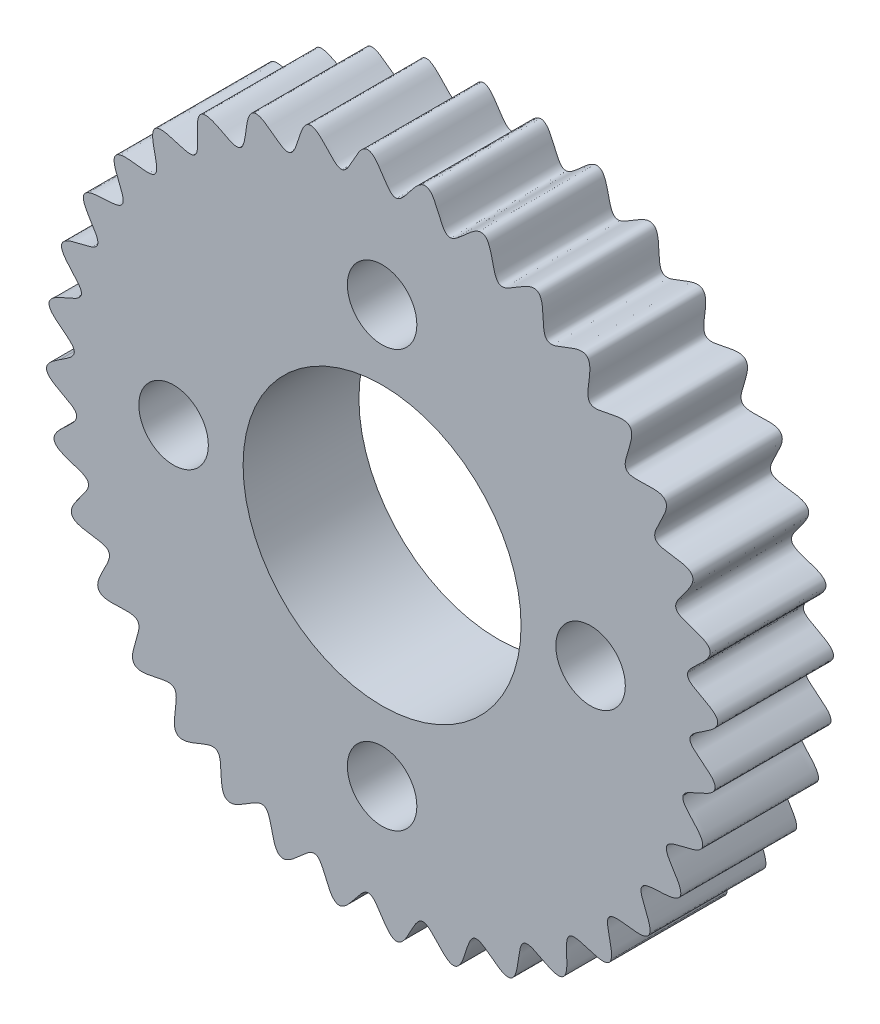
from build123d import *

# Parameters (mm, degrees)
SKETCH_1_R          = 12
EXTRUDE_1_DEPTH     = 10
SKETCH_2_R          = 3
CUT_EXTRUDE_1_DEPTH = 10


with BuildPart() as part:
    # 草图1 → 凸台-拉伸1 (new body)
    with BuildSketch(Plane.XY):
        with BuildLine():
            add(Edge.make_bspline(
                [(27.8, 0), (27.879086903, 0.050893887), (27.971336732, 0.111103249), (28.194533481, 0.258808628), (28.294049855, 0.336092728), (28.417370088, 0.426086376), (28.501278415, 0.498040732), (28.622785002, 0.60193849), (28.715550657, 0.697734174), (28.807132403, 0.807680639), (28.870681996, 0.900507067), (28.936409474, 1.025538972), (28.984042853, 1.184831126), (28.973296669, 1.377900934), (28.880794908, 1.571235405), (28.750315987, 1.731505647), (28.547325084, 1.91602641), (28.265698227, 2.109835643), (27.910306403, 2.312106458), (27.539864559, 2.503239109), (27.223608825, 2.669344446), (26.927397078, 2.838734122), (26.700188585, 2.990953033), (26.498086038, 3.166743573), (26.370908864, 3.391004275), (26.356430991, 3.592019791), (26.430018399, 3.818671801), (26.56512916, 4.020814312), (26.730827575, 4.211649336), (26.917184592, 4.399244762), (27.084143049, 4.557202823), (27.253332176, 4.712918318), (27.422614194, 4.868396469), (27.590305373, 5.025738359), (27.754250066, 5.186850897), (27.911041976, 5.352895005), (28.056676237, 5.526394246), (28.186171878, 5.710966213), (28.287869973, 5.910349115), (28.34201641, 6.126003938), (28.312098938, 6.345259812), (28.172373356, 6.573230019), (27.960820756, 6.740200125), (27.721028536, 6.872546037), (27.461750224, 6.984182042), (27.238477196, 7.067688137), (27.012456826, 7.144181074), (26.785443426, 7.216899189), (26.557892275, 7.288618547), (26.331273922, 7.362408013), (26.113781842, 7.43906723), (25.908178465, 7.52274658), (25.715756985, 7.61834712), (25.544697275, 7.733280458), (25.400011883, 7.885351659), (25.330486689, 8.087592553), (25.354871409, 8.296728464), (25.425840851, 8.490064125), (25.526610466, 8.679819619), (25.645961339, 8.866813634), (25.779416237, 9.05472223), (25.92239085, 9.24525649), (26.103745171, 9.481697328), (26.283943101, 9.718875409), (26.457504471, 9.961190202), (26.611206515, 10.207142911), (26.715361124, 10.403517182), (26.79562524, 10.602702602), (26.842072945, 10.804243307), (26.836798525, 11.013987828), (26.75119136, 11.207759856), (26.564257659, 11.390904846), (26.323655987, 11.510151758), (26.063101473, 11.593758588), (25.788074573, 11.65561909), (25.553656692, 11.697354098), (25.317978038, 11.732462675), (25.082005189, 11.764169314), (24.845804513, 11.795450723), (24.610177946, 11.829379504), (24.383256136, 11.86874231), (24.166933345, 11.917715336), (23.962395363, 11.982992828), (23.776853656, 12.07267222), (23.620775011, 12.205970898), (23.538369624, 12.389782291), (23.531717159, 12.58147316), (23.562982453, 12.762897328), (23.620808426, 12.949847233), (23.697496498, 13.14188267), (23.813453435, 13.392298028), (23.944533062, 13.648015836), (24.077803909, 13.90261077), (24.207499367, 14.159076038), (24.306457278, 14.366565583), (24.397004178, 14.576211413), (24.474508501, 14.789059923), (24.53308054, 15.006794776), (24.560430992, 15.228926187), (24.537586129, 15.450111193), (24.434435544, 15.6458875), (24.26640897, 15.779613952), (24.076288525, 15.861486218), (23.809455077, 15.927118569), (23.468554136, 15.958819166), (23.118724552, 15.958945935), (22.761289762, 15.945389342), (22.46342862, 15.932420039), (22.225194411, 15.924210208), (21.994627654, 15.921885696), (21.772787608, 15.930183232), (21.559281487, 15.954213572), (21.359224813, 16.003707181), (21.171254791, 16.097121806), (21.036752381, 16.263389544), (20.988135782, 16.468247409), (20.988705496, 16.674208308), (21.018487147, 16.886961041), (21.066704156, 17.103542736), (21.14362914, 17.383196742), (21.250439114, 17.724245634), (21.358755746, 18.06503286), (21.454982526, 18.409430546), (21.515312013, 18.693159268), (21.5460116, 18.913291704), (21.553315265, 19.127929077), (21.528028111, 19.333195278), (21.451336325, 19.528489846), (21.304617219, 19.681294935), (21.066318218, 19.789460951), (20.79944135, 19.819224862), (20.526005267, 19.808675346), (20.24640681, 19.772740077), (20.011851936, 19.731782731), (19.778378556, 19.684167041), (19.545792313, 19.633254106), (19.313137432, 19.581863655), (19.080116496, 19.533157143), (18.853416991, 19.492534458), (18.633390103, 19.464566953), (18.418861342, 19.455952127), (18.213836575, 19.476763423), (18.021580452, 19.548642329), (17.881276504, 19.693182449), (17.809464837, 19.871040739), (17.776790566, 20.052211205), (17.767194822, 20.247675312), (17.773566186, 20.454337552), (17.792043882, 20.672043753), (17.818304504, 20.900375354), (17.847881812, 21.128406721), (17.8775822, 21.356326194), (17.904926068, 21.5846444), (17.926940799, 21.813447093), (17.940326438, 22.041426775), (17.940362404, 22.267948189), (17.920921514, 22.492575075), (17.870667982, 22.710683722), (17.77352218, 22.910686442), (17.609675518, 23.059419976), (17.356091166, 23.14423359), (17.086730496, 23.136172503), (16.817922967, 23.083390388), (16.490432854, 22.985136235), (16.211054636, 22.881047447), (15.934942337, 22.768604598), (15.659525205, 22.654511151), (15.438440123, 22.565334618), (15.222589959, 22.484279802), (15.011280808, 22.416209654), (14.802436989, 22.365764804), (14.597514908, 22.343850084), (14.388932374, 22.367343664), (14.205674013, 22.477577459), (14.089923895, 22.653461062), (14.020016996, 22.847180019), (13.975235357, 23.057320162), (13.946472471, 23.277273078), (13.927908085, 23.507019631), (13.914978441, 23.744852499), (13.904506054, 23.983050193), (13.893282615, 24.221046437), (13.878354587, 24.458988334), (13.856415244, 24.696296421), (13.824330138, 24.924495378), (13.777909065, 25.141850386), (13.711350077, 25.346041523), (13.617389698, 25.530280879), (13.478523219, 25.687565835), (13.288394893, 25.78097755), (13.027464627, 25.801111984), (12.766516586, 25.737814401), (12.513153333, 25.634360605), (12.209785855, 25.477632394), (11.902783133, 25.294859669), (11.60197022, 25.101924315), (11.300186174, 24.910902555), (11.049608034, 24.765235253), (10.852367464, 24.663707124), (10.653749362, 24.582235009), (10.453957778, 24.531670512), (10.248719233, 24.533458118), (10.067436975, 24.621295193), (9.939127491, 24.763865927), (9.846458097, 24.922935447), (9.770589556, 25.103329535), (9.705893204, 25.299707745), (9.648797188, 25.510604368), (9.59537974, 25.734147527), (9.545182259, 25.958543039), (9.495138198, 26.18287525), (9.442743899, 26.406776632), (9.385175425, 26.629309812), (9.319780829, 26.848119633), (9.242338695, 27.060991081), (9.147244881, 27.265424181), (9.025422115, 27.453188474), (8.865733384, 27.607908228), (8.660893166, 27.691626792), (8.39360259, 27.684606044), (8.143225768, 27.58488113), (7.90871486, 27.443387961), (7.682396011, 27.274664342), (7.498441146, 27.123057281), (7.319186096, 26.965564369), (7.142703698, 26.805324045), (6.966817291, 26.644118669), (6.789604628, 26.484756111), (6.614469657, 26.334732122), (6.439199682, 26.19851394), (6.260196224, 26.079672478), (6.075131506, 25.988996859), (5.871090792, 25.939731587), (5.661183212, 25.980640903), (5.492257219, 26.106327599), (5.360310917, 26.264454938), (5.246357455, 26.44660543), (5.144101081, 26.643456374), (5.048078172, 26.852997932), (4.954584737, 27.072065638), (4.863275451, 27.292316419), (4.771329389, 27.512121131), (4.675920691, 27.730607665), (4.574140318, 27.946100641), (4.465941534, 28.149563755), (4.347980207, 28.337933716), (4.215597733, 28.507046103), (4.064290289, 28.648038125), (3.880003859, 28.748342504), (3.669392986, 28.771093086), (3.417312359, 28.700769858), (3.193750459, 28.5520401), (2.991050161, 28.368169996), (2.759582186, 28.117135864), (2.533605948, 27.840384568), (2.31692205, 27.556200564), (2.098671099, 27.273482603), (1.913025822, 27.050897343), (1.762404978, 26.888031862), (1.603630118, 26.743541724), (1.433181517, 26.627693893), (1.239708974, 26.559177977), (1.039317325, 26.579715644), (0.869983787, 26.669803882), (0.728498061, 26.787585538), (0.595506541, 26.931151962), (0.467546553, 27.093559661), (0.341762955, 27.272209674), (0.21511071, 27.464001687), (0.091192722, 27.657695945), (-0.032559447, 27.85138319), (-0.158372766, 28.043861761), (-0.288580267, 28.233284971), (-0.424868452, 28.416532676), (-0.570446577, 28.590079635), (-0.729725771, 28.749659911), (-0.908420895, 28.884434791), (-1.11139649, 28.975207041), (-1.332516766, 28.983817275), (-1.581286513, 28.885801171), (-1.782455831, 28.706456485), (-1.954430496, 28.493288951), (-2.109393756, 28.257334995), (-2.230402144, 28.05195471), (-2.344980994, 27.842650907), (-2.456014868, 27.631713786), (-2.566158397, 27.420073482), (-2.678178866, 27.209711543), (-2.79144028, 27.008835121), (-2.909551449, 26.820886509), (-3.0371126, 26.647988599), (-3.180005, 26.49948653), (-3.354888818, 26.383404771), (-3.566132369, 26.35005668), (-3.767852793, 26.410383356), (-3.945934951, 26.513853988), (-4.115294339, 26.646029356), (-4.278749293, 26.796063883), (-4.482477508, 27.002533923), (-4.724423488, 27.265513776), (-4.965405567, 27.529786358), (-5.215535578, 27.785218378), (-5.469388732, 28.013960538), (-5.689003034, 28.1774426), (-5.927139279, 28.302524486), (-6.186505546, 28.341682864), (-6.392189073, 28.290966382), (-6.605021186, 28.138715389), (-6.764225659, 27.922442246), (-6.891822069, 27.680389774), (-7.00048006, 27.42026614), (-7.082320502, 27.196669711), (-7.1577628, 26.970654543), (-7.230062219, 26.743789915), (-7.301720669, 26.516583786), (-7.376317268, 26.29046888), (-7.47146589, 26.025331105), (-7.581966336, 25.775207319), (-7.719978263, 25.545598316), (-7.91873902, 25.381454162), (-8.114215905, 25.33223945), (-8.304054838, 25.358963631), (-8.477354917, 25.421261642), (-8.651384434, 25.51067688), (-8.827205101, 25.61953041), (-9.00648562, 25.744382769), (-9.191108118, 25.881292661), (-9.373793464, 26.02092205), (-9.556331461, 26.160603638), (-9.740386424, 26.298442941), (-9.92752948, 26.43190969), (-10.118271979, 26.557491923), (-10.314427805, 26.6707835), (-10.518680562, 26.76626113), (-10.732695105, 26.831793843), (-10.954475347, 26.847665621), (-11.165205772, 26.780135375), (-11.365448599, 26.602934644), (-11.493147988, 26.36562499), (-11.581840827, 26.106450664), (-11.660495752, 25.773689917), (-11.710040486, 25.479731727), (-11.750719678, 25.184331504), (-11.78961839, 24.888851215), (-11.822935166, 24.652656734), (-11.869089644, 24.374648785), (-11.930455835, 24.107647888), (-12.020423793, 23.85585111), (-12.176220373, 23.644905792), (-12.363316911, 23.541228897), (-12.573510252, 23.528986279), (-12.776230159, 23.56526564), (-12.980607076, 23.631580147), (-13.185473721, 23.716628664), (-13.393722076, 23.815436641), (-13.606156223, 23.923148187), (-13.817677815, 24.033182545), (-14.029399983, 24.142457297), (-14.242928364, 24.248503474), (-14.459411755, 24.34815362), (-14.673082255, 24.434471979), (-14.884524819, 24.502939723), (-15.094643237, 24.547404599), (-15.301173185, 24.558136063), (-15.506828442, 24.516540603), (-15.682775618, 24.398554571), (-15.801121159, 24.225884742), (-15.874675821, 24.032755026), (-15.920324819, 23.823057751), (-15.94581756, 23.6023968), (-15.956611013, 23.372354624), (-15.956981754, 23.134192807), (-15.950646527, 22.896033778), (-15.940886259, 22.658118456), (-15.930682082, 22.420087368), (-15.923175868, 22.182140743), (-15.922538306, 21.951836115), (-15.933201792, 21.730292616), (-15.961970995, 21.517528576), (-16.018067986, 21.319231688), (-16.122239981, 21.142378408), (-16.288947642, 21.029304894), (-16.47657389, 20.989469119), (-16.660665756, 20.988751066), (-16.85482664, 21.013243166), (-17.057242811, 21.055404186), (-17.268432978, 21.111405523), (-17.488735561, 21.176916459), (-17.70816663, 21.245641791), (-17.927465986, 21.314468546), (-18.147567461, 21.381044397), (-18.369071061, 21.442455254), (-18.591263237, 21.495226766), (-18.814336378, 21.534595645), (-19.038927547, 21.554458531), (-19.262447575, 21.542839069), (-19.476283179, 21.481904448), (-19.651205691, 21.346366898), (-19.778770833, 21.111376094), (-19.817594935, 20.844680949), (-19.81231371, 20.57084196), (-19.779354195, 20.290482279), (-19.740036061, 20.055369162), (-19.693270723, 19.821383279), (-19.642739731, 19.588424877), (-19.591074983, 19.355500092), (-19.541669291, 19.122348145), (-19.499312191, 18.895664817), (-19.468978772, 18.675767475), (-19.455560776, 18.461325202), (-19.469565746, 18.255716645), (-19.528921126, 18.054379567), (-19.669303422, 17.893048929), (-19.862614291, 17.809598075), (-20.065529734, 17.774392897), (-20.280253421, 17.766781546), (-20.501859521, 17.776650408), (-20.731339296, 17.798262895), (-20.967804199, 17.82682908), (-21.204201635, 17.857878274), (-21.440531095, 17.888153062), (-21.677450392, 17.914769878), (-21.91496287, 17.934372137), (-22.145266651, 17.942400534), (-22.367380229, 17.934428426), (-22.580027459, 17.904337436), (-22.777783311, 17.843798234), (-22.956793469, 17.734352395), (-23.081800307, 17.563335231), (-23.14694111, 17.309861839), (-23.12991394, 17.041893758), (-23.072035792, 16.774402326), (-22.970354515, 16.448449706), (-22.864805878, 16.170015681), (-22.75181371, 15.894557836), (-22.638067504, 15.619401873), (-22.549628737, 15.398330635), (-22.470262459, 15.182159429), (-22.404509768, 14.970314206), (-22.358774448, 14.760549826), (-22.343667363, 14.555021541), (-22.381068548, 14.353206659), (-22.499050915, 14.18993437), (-22.66173404, 14.088328639), (-22.834484452, 14.024692473), (-23.025301005, 13.981296753), (-23.229952322, 13.951692454), (-23.504797355, 13.926906874), (-23.791794416, 13.912565626), (-24.078916858, 13.900684977), (-24.365868147, 13.884770724), (-24.595041472, 13.86672796), (-24.821867892, 13.840317501), (-25.044961638, 13.801019689), (-25.26279726, 13.742868381), (-25.468865503, 13.655502091), (-25.648963213, 13.525105781), (-25.766980658, 13.337915343), (-25.806480698, 13.073466232), (-25.75174863, 12.809576261), (-25.653127219, 12.554057987), (-25.526266887, 12.30187893), (-25.408906425, 12.094392435), (-25.284933547, 11.890512332), (-25.157773449, 11.688885647), (-25.029559518, 11.487678337), (-24.90339068, 11.285484911), (-24.786057768, 11.086959244), (-24.682344353, 10.890697973), (-24.596391987, 10.693777377), (-24.539230084, 10.495778551), (-24.526144561, 10.28628285), (-24.60288244, 10.086668065), (-24.755993366, 9.942133705), (-24.934630627, 9.839650485), (-25.133801662, 9.759058339), (-25.345418617, 9.692538266), (-25.568450994, 9.63436069), (-25.800425496, 9.580328306), (-26.033185926, 9.528652412), (-26.265617474, 9.476271818), (-26.497352426, 9.420252528), (-26.727245265, 9.357438142), (-26.946406317, 9.286214548), (-27.152397532, 9.202754778), (-27.341929776, 9.101750468), (-27.50705249, 8.977223382), (-27.637836367, 8.813156347), (-27.696810059, 8.609692779), (-27.671334972, 8.349235825), (-27.563672927, 8.103232511), (-27.417818675, 7.871704105), (-27.246898627, 7.647532714), (-27.094151067, 7.464880711), (-26.936177993, 7.286494801), (-26.775792968, 7.110525599), (-26.614960096, 6.934735832), (-26.456268549, 6.75728701), (-26.307738521, 6.58127084), (-26.173504506, 6.404705708), (-26.058779468, 6.223225769), (-25.974290195, 6.035263462), (-25.940411093, 5.832825324), (-25.995434534, 5.63904848), (-26.113558499, 5.487928607), (-26.254119588, 5.369046625), (-26.418598601, 5.263004415), (-26.600759027, 5.165191056), (-26.798536985, 5.072340113), (-27.009408247, 4.980916671), (-27.221677885, 4.8925157), (-27.433912088, 4.804277234), (-27.645313462, 4.713798647), (-27.854469649, 4.618462566), (-28.058598868, 4.516065113), (-28.254789823, 4.402835416), (-28.439602463, 4.273685875), (-28.603362583, 4.121110407), (-28.727998204, 3.936978767), (-28.774880352, 3.720715987), (-28.721541681, 3.458699839), (-28.57987472, 3.229454902), (-28.399770342, 3.023055981), (-28.150917669, 2.788561266), (-27.8751532, 2.560690245), (-27.590881035, 2.343285953), (-27.307450296, 2.125309079), (-27.083265126, 1.941002415), (-26.918641808, 1.792064375), (-26.770539072, 1.636374632), (-26.649104129, 1.469941993), (-26.563821719, 1.274409648), (-26.569725361, 1.053593706), (-26.674435754, 0.858409487), (-26.818010022, 0.695347464), (-26.986562923, 0.549741366), (-27.15649714, 0.421832683), (-27.34632326, 0.2923618), (-27.510802363, 0.185038308), (-27.682345834, 0.075397318), (-27.761627832, 0.0246932), (-27.8, 0)],
                knots=[0.082670353, 0.082670353, 0.082670353, 0.082670353, 0.082670353, 0.08562947, 0.086369249, 0.087109028, 0.087848807, 0.088588586, 0.090068144, 0.090807924, 0.091547703, 0.092287482, 0.093027261, 0.094506819, 0.095857625, 0.097208432, 0.098559238, 0.099910044, 0.103036654, 0.106163263, 0.109289872, 0.110853177, 0.112416481, 0.115116754, 0.11646689, 0.117817027, 0.119022166, 0.120227306, 0.122637585, 0.124146531, 0.125655477, 0.127164423, 0.128673368, 0.130182314, 0.13169126, 0.133200206, 0.134709152, 0.136173258, 0.137637365, 0.139101472, 0.140565578, 0.1419173, 0.143269023, 0.145972467, 0.147537754, 0.149103042, 0.150668329, 0.152233616, 0.153798904, 0.155364191, 0.156929479, 0.158494766, 0.159846203, 0.161197639, 0.162549076, 0.163900512, 0.165251235, 0.166601958, 0.16795268, 0.169303403, 0.170867738, 0.172432073, 0.173996408, 0.175560743, 0.178689413, 0.180253748, 0.181818083, 0.183169301, 0.184520518, 0.185871736, 0.187222954, 0.18857376, 0.189924566, 0.192626179, 0.194189483, 0.195752788, 0.197316093, 0.198879397, 0.200442702, 0.202006007, 0.203569311, 0.205132616, 0.206482752, 0.207832888, 0.209183025, 0.210533161, 0.211738301, 0.21294344, 0.21414858, 0.21535372, 0.216862665, 0.218371611, 0.221389503, 0.222898449, 0.224407394, 0.22591634, 0.227425286, 0.228889393, 0.230353499, 0.231817606, 0.233281713, 0.234633435, 0.235985157, 0.237336879, 0.238688601, 0.241819176, 0.244949751, 0.246515038, 0.248080326, 0.249645613, 0.2512109, 0.252562337, 0.253913774, 0.25526521, 0.256616647, 0.257967369, 0.259318092, 0.260668815, 0.262019537, 0.263583872, 0.265148207, 0.268276877, 0.271405548, 0.272969883, 0.274534218, 0.275885435, 0.277236653, 0.27858787, 0.279939088, 0.281289894, 0.2826407, 0.285342313, 0.286905618, 0.288468922, 0.290032227, 0.291595532, 0.293158836, 0.294722141, 0.296285446, 0.29784875, 0.299198887, 0.300549023, 0.301899159, 0.303249295, 0.304454435, 0.305659575, 0.306864714, 0.308069854, 0.3095788, 0.311087746, 0.312596691, 0.314105637, 0.315614583, 0.317123529, 0.318632475, 0.32014142, 0.321605527, 0.323069634, 0.32453374, 0.325997847, 0.327349569, 0.328701291, 0.331404736, 0.332970023, 0.33453531, 0.337665885, 0.339231173, 0.34079646, 0.342361747, 0.343927035, 0.345278471, 0.346629908, 0.347981345, 0.349332781, 0.350683504, 0.352034226, 0.353384949, 0.354735672, 0.356300007, 0.357864342, 0.359428677, 0.360993012, 0.362557347, 0.364121682, 0.365686017, 0.367250352, 0.36860157, 0.369952787, 0.371304005, 0.372655222, 0.374006029, 0.375356835, 0.378058447, 0.379621752, 0.381185057, 0.384311666, 0.387438275, 0.38900158, 0.390564885, 0.391915021, 0.393265157, 0.394615293, 0.39596543, 0.397170569, 0.398375709, 0.399580849, 0.400785988, 0.402294934, 0.40380388, 0.405312826, 0.406821772, 0.408330717, 0.409839663, 0.411348609, 0.412857555, 0.414321661, 0.415785768, 0.417249875, 0.418713982, 0.420065704, 0.421417426, 0.42412087, 0.425686157, 0.427251445, 0.428816732, 0.43038202, 0.431947307, 0.433512594, 0.435077882, 0.436643169, 0.437994606, 0.439346042, 0.440697479, 0.442048916, 0.443399638, 0.444750361, 0.446101083, 0.447451806, 0.449016141, 0.450580476, 0.452144811, 0.453709146, 0.455273481, 0.456837816, 0.458402151, 0.459966486, 0.461317704, 0.462668922, 0.464020139, 0.465371357, 0.466722163, 0.468072969, 0.470774582, 0.472337886, 0.473901191, 0.4770278, 0.48015441, 0.481717714, 0.483281019, 0.484631155, 0.485981292, 0.487331428, 0.488681564, 0.489886704, 0.491091843, 0.492296983, 0.493502123, 0.495011069, 0.496520014, 0.49802896, 0.499537906, 0.501046852, 0.502555798, 0.504064743, 0.505573689, 0.507037796, 0.508501903, 0.509966009, 0.511430116, 0.512781838, 0.51413356, 0.516837004, 0.518402292, 0.519967579, 0.521532867, 0.523098154, 0.524663441, 0.526228729, 0.527794016, 0.529359304, 0.53071074, 0.532062177, 0.533413613, 0.53476505, 0.536115773, 0.537466495, 0.538817218, 0.54016794, 0.541732275, 0.54329661, 0.546425281, 0.549553951, 0.551118286, 0.552682621, 0.555385056, 0.556736274, 0.558087491, 0.559438297, 0.560789104, 0.563490716, 0.565054021, 0.566617326, 0.56818063, 0.569743935, 0.57130724, 0.572870544, 0.574433849, 0.575997153, 0.578697426, 0.580047562, 0.581397699, 0.582602838, 0.583807978, 0.585013118, 0.586218257, 0.587727203, 0.589236149, 0.590745095, 0.59225404, 0.593762986, 0.595271932, 0.596780878, 0.598289824, 0.59975393, 0.601218037, 0.602682144, 0.60414625, 0.605497972, 0.606849695, 0.609553139, 0.611118426, 0.612683714, 0.615814288, 0.617379576, 0.618944863, 0.620510151, 0.622075438, 0.624778311, 0.626129748, 0.627481184, 0.628831907, 0.63018263, 0.631533352, 0.632884075, 0.63444841, 0.636012745, 0.63757708, 0.639141415, 0.64070575, 0.642270085, 0.64383442, 0.645398755, 0.646749973, 0.64810119, 0.649452408, 0.650803626, 0.652154432, 0.653505238, 0.654856044, 0.656206851, 0.657770155, 0.65933346, 0.660896765, 0.662460069, 0.664023374, 0.665586679, 0.667149983, 0.668713288, 0.670063424, 0.67141356, 0.672763697, 0.674113833, 0.675318973, 0.676524112, 0.677729252, 0.678934392, 0.680443337, 0.681952283, 0.683461229, 0.684970175, 0.686479121, 0.687988066, 0.689497012, 0.691005958, 0.692470065, 0.693934171, 0.695398278, 0.696862385, 0.698214107, 0.699565829, 0.702269273, 0.703834561, 0.705399848, 0.706965135, 0.708530423, 0.71009571, 0.711660998, 0.713226285, 0.714791572, 0.716143009, 0.717494446, 0.718845882, 0.720197319, 0.721548041, 0.722898764, 0.724249487, 0.725600209, 0.727164544, 0.728728879, 0.730293214, 0.731857549, 0.733421884, 0.73498622, 0.736550555, 0.73811489, 0.739466107, 0.740817325, 0.742168542, 0.74351976, 0.744870566, 0.746221372, 0.748922985, 0.75048629, 0.752049594, 0.755176204, 0.756739508, 0.758302813, 0.759866118, 0.761429422, 0.762779559, 0.764129695, 0.765479831, 0.766829967, 0.768035107, 0.769240247, 0.770445386, 0.771650526, 0.773159472, 0.774668418, 0.777686309, 0.779195255, 0.780704201, 0.782213147, 0.783722092, 0.785186199, 0.786650306, 0.788114412, 0.789578519, 0.790930241, 0.792281963, 0.794985408, 0.796550695, 0.798115982, 0.79968127, 0.801246557, 0.802811845, 0.804377132, 0.805942419, 0.807507707, 0.808859143, 0.81021058, 0.811562017, 0.812913453, 0.814264176, 0.815614898, 0.816965621, 0.818316344, 0.819880679, 0.821445014, 0.823009349, 0.824573684, 0.826138019, 0.827702354, 0.829266689, 0.830831024, 0.832182242, 0.833533459, 0.834884677, 0.836235894, 0.837586701, 0.838937507, 0.841639119, 0.843202424, 0.844765729, 0.846329033, 0.847892338, 0.849455643, 0.851018947, 0.852582252, 0.854145557, 0.855495693, 0.856845829, 0.858195965, 0.859546102, 0.860751241, 0.861956381, 0.863161521, 0.86436666, 0.865875606, 0.867384552, 0.868893498, 0.870402444, 0.871911389, 0.873420335, 0.874929281, 0.876438227, 0.877902333, 0.87936644, 0.880830547, 0.882294654, 0.883646376, 0.884998098, 0.887701542, 0.889266829, 0.890832117, 0.893962692, 0.897093266, 0.898658554, 0.900223841, 0.901575278, 0.902926714, 0.904278151, 0.905629588, 0.907065321, 0.908501054, 0.909936788, 0.911372521, 0.912808255, 0.914243988, 0.915679722, 0.917115455, 0.917115455, 0.917115455, 0.917115455, 0.917115455], degree=4))
            add(Edge.make_bspline(
                [(-27.8, 0), (-27.879086903, -0.050893887), (-27.971171842, -0.110989549), (-28.19440882, -0.258734617), (-28.294476619, -0.336365894), (-28.416297571, -0.425394618), (-28.503010445, -0.499160722), (-28.64382066, -0.620599427), (-28.773249591, -0.758138738), (-28.907500046, -0.945598437), (-28.984790533, -1.155271487), (-28.973801822, -1.378214693), (-28.880476845, -1.57103536), (-28.750484051, -1.731615905), (-28.547199099, -1.915933847), (-28.265798631, -2.109926145), (-27.910218234, -2.312002188), (-27.539933702, -2.503348667), (-27.223542774, -2.669209585), (-26.972140607, -2.81337278), (-26.78557225, -2.933429833), (-26.615718889, -3.064698809), (-26.472026554, -3.212442855), (-26.370958787, -3.391077485), (-26.356384845, -3.591991664), (-26.415701262, -3.774395908), (-26.507123925, -3.934184973), (-26.625416144, -4.090085928), (-26.763136051, -4.244303838), (-26.917230131, -4.399198676), (-27.084115345, -4.557231163), (-27.253348822, -4.712901196), (-27.422604295, -4.868406727), (-27.590311176, -5.025732234), (-27.754246795, -5.186854538), (-27.911043557, -5.352892914), (-28.056675889, -5.526395355), (-28.186171234, -5.710965773), (-28.287871519, -5.91034922), (-28.342013948, -6.12600404), (-28.312102588, -6.345259511), (-28.172365708, -6.573230771), (-27.960836123, -6.740198511), (-27.721000564, -6.87254906), (-27.406953496, -7.007792333), (-27.126064539, -7.10762968), (-26.842215977, -7.198986567), (-26.557979391, -7.288603942), (-26.331158625, -7.36242929), (-26.065388897, -7.456158177), (-25.813100447, -7.56295625), (-25.580751823, -7.695281515), (-25.400065033, -7.885341386), (-25.330452145, -8.087598876), (-25.354895298, -8.296724783), (-25.425825367, -8.490065075), (-25.526622101, -8.679821661), (-25.645953318, -8.866807406), (-25.779421961, -9.054734148), (-25.92238625, -9.245237093), (-26.067478719, -9.434437812), (-26.21185946, -9.623968291), (-26.353371774, -9.815837617), (-26.489102647, -10.011728672), (-26.611208693, -10.207163019), (-26.715359865, -10.403505563), (-26.795625867, -10.602708314), (-26.842072612, -10.804240435), (-26.836798708, -11.013989316), (-26.751191265, -11.207759043), (-26.564257729, -11.390905535), (-26.323655935, -11.510151212), (-26.063101506, -11.593758933), (-25.788074556, -11.655618905), (-25.553656699, -11.697354211), (-25.317978041, -11.732462615), (-25.082005175, -11.764169336), (-24.845804544, -11.795450733), (-24.610177888, -11.829379458), (-24.383256236, -11.868742401), (-24.166933182, -11.917715188), (-23.962395593, -11.982993033), (-23.776853275, -12.072671908), (-23.620775613, -12.205971363), (-23.53836863, -12.389781513), (-23.531718942, -12.58147462), (-23.56297902, -12.762894443), (-23.620814724, -12.949852561), (-23.697484405, -13.1418724), (-23.789307763, -13.340129582), (-23.892078566, -13.545709418), (-23.997863625, -13.74987281), (-24.103725668, -13.953888872), (-24.207510315, -14.159085739), (-24.306451884, -14.366560315), (-24.397004965, -14.576213219), (-24.474511962, -14.789061042), (-24.533072961, -15.006791011), (-24.560443836, -15.228932976), (-24.537567144, -15.450101093), (-24.434463682, -15.645902032), (-24.225194349, -15.812334854), (-23.96929267, -15.896880289), (-23.698696812, -15.939230921), (-23.416873075, -15.955456091), (-23.178504329, -15.95756225), (-22.939952501, -15.952138604), (-22.701758648, -15.942828096), (-22.463401024, -15.932395212), (-22.225211967, -15.924226519), (-21.994617247, -15.921876061), (-21.772793266, -15.930188247), (-21.559278902, -15.95421162), (-21.359225822, -16.003707353), (-21.171254689, -16.097122869), (-21.036751748, -16.263387041), (-20.988137475, -16.468252572), (-20.988701809, -16.674197779), (-21.018494846, -16.886982642), (-21.066690856, -17.103505331), (-21.127831356, -17.325751), (-21.19701274, -17.553654497), (-21.268660679, -17.781082794), (-21.339479898, -18.008541756), (-21.406888757, -18.23727765), (-21.467345973, -18.467716209), (-21.526119762, -18.743632543), (-21.557872701, -19.015529855), (-21.547138876, -19.284321943), (-21.451363186, -19.528509126), (-21.304601664, -19.681283807), (-21.066331654, -19.789470556), (-20.799430689, -19.819217238), (-20.526012035, -19.808680187), (-20.246403126, -19.772737444), (-20.011854278, -19.731784405), (-19.77837712, -19.684166016), (-19.545793187, -19.633254728), (-19.313136895, -19.581863274), (-19.080116835, -19.533157382), (-18.853416781, -19.49253431), (-18.633390231, -19.464567044), (-18.418861267, -19.455952066), (-18.21383662, -19.476763489), (-18.021580451, -19.548642269), (-17.881276468, -19.69318248), (-17.809464885, -19.87104074), (-17.776790526, -20.052211192), (-17.767194861, -20.247675328), (-17.773566146, -20.454337532), (-17.792043926, -20.672043778), (-17.818304448, -20.90037532), (-17.847881894, -21.128406772), (-17.877582072, -21.356326112), (-17.904926277, -21.584644534), (-17.926940455, -21.813446871), (-17.940327, -22.041427136), (-17.940361511, -22.267947618), (-17.920922814, -22.492575906), (-17.870665996, -22.710682461), (-17.773524987, -22.910688219), (-17.609671559, -23.059417455), (-17.356099334, -23.144238823), (-17.086714173, -23.136162014), (-16.817952472, -23.08340936), (-16.547575452, -23.002266632), (-16.32286175, -22.922718871), (-16.100551358, -22.836032763), (-15.879906725, -22.745816682), (-15.659492094, -22.654489818), (-15.438461431, -22.565348388), (-15.222577214, -22.484271499), (-15.011287863, -22.416214352), (-14.802433597, -22.365762405), (-14.597516532, -22.343851471), (-14.388931646, -22.367342712), (-14.205674235, -22.477578326), (-14.089924135, -22.653459951), (-14.020016046, -22.847181879), (-13.975237612, -23.057316539), (-13.946468218, -23.277279478), (-13.927915305, -23.507009005), (-13.914967139, -23.744869004), (-13.901911374, -24.042565516), (-13.887495862, -24.340083458), (-13.864694639, -24.637270455), (-13.824341884, -24.92447894), (-13.77790199, -25.141859635), (-13.711353959, -25.346037322), (-13.617387075, -25.530282436), (-13.478525496, -25.687565753), (-13.288392304, -25.780976518), (-13.027469475, -25.801115024), (-12.766507453, -25.73780772), (-12.513169686, -25.634373027), (-12.262723689, -25.504977057), (-12.056322432, -25.386266998), (-11.853214747, -25.26167044), (-11.652068424, -25.134278662), (-11.451020908, -25.006414825), (-11.248711479, -24.880947804), (-11.049577381, -24.765239163), (-10.852385216, -24.663704703), (-10.653740538, -24.582236212), (-10.453962409, -24.53166991), (-10.248716744, -24.533458431), (-10.067438447, -24.621294988), (-9.939126534, -24.763866088), (-9.846458733, -24.922935331), (-9.770589082, -25.103329622), (-9.705893508, -25.299707695), (-9.648796992, -25.510604385), (-9.595379873, -25.734147541), (-9.545182148, -25.958542988), (-9.495138319, -26.182875351), (-9.442743736, -26.406776452), (-9.385175676, -26.629310121), (-9.319780431, -26.84811912), (-9.242339324, -27.060991906), (-9.147243966, -27.265422974), (-9.025423509, -27.453190325), (-8.865731401, -27.607905581), (-8.660896002, -27.691630557), (-8.393596705, -27.684598279), (-8.143237529, -27.584896607), (-7.908693617, -27.443360023), (-7.634558478, -27.239023124), (-7.407629288, -27.045658664), (-7.18662632, -26.845560997), (-6.966841128, -26.644150001), (-6.78958928, -26.484735946), (-6.614478854, -26.334744189), (-6.439194563, -26.198507243), (-6.26019873, -26.079675729), (-6.075130211, -25.988995227), (-5.871091529, -25.939732481), (-5.661182732, -25.980640317), (-5.492257545, -26.106328027), (-5.360310717, -26.264454654), (-5.246357599, -26.446605645), (-5.144100988, -26.643456229), (-5.048078228, -26.852998024), (-4.954584704, -27.072065581), (-4.86327547, -27.292316455), (-4.771329378, -27.512121107), (-4.675920698, -27.730607683), (-4.574140315, -27.946100625), (-4.465941536, -28.149563771), (-4.347980206, -28.3379337), (-4.215597734, -28.507046121), (-4.064290279, -28.6480381), (-3.880003879, -28.748342519), (-3.669392967, -28.77109309), (-3.417312373, -28.700769844), (-3.193750452, -28.552040111), (-2.991050165, -28.368169992), (-2.759582184, -28.117135865), (-2.533605951, -27.84038457), (-2.316922047, -27.556200558), (-2.098671102, -27.273482611), (-1.913025818, -27.05089733), (-1.762404982, -26.888031883), (-1.603630117, -26.743541693), (-1.4331815, -26.62769394), (-1.239709016, -26.559177947), (-1.039317275, -26.579715636), (-0.869983824, -26.669803917), (-0.728498041, -26.787585506), (-0.595506556, -26.931151986), (-0.467546545, -27.093559652), (-0.341762954, -27.272209662), (-0.215110719, -27.464001723), (-0.091192701, -27.657695873), (0.032559408, -27.851383319), (0.158372835, -28.043861541), (0.288580151, -28.233285344), (0.424868643, -28.41653206), (0.570446273, -28.590080624), (0.729726216, -28.749658464), (0.90842022, -28.884437007), (1.111397448, -28.975203874), (1.332515389, -28.983821784), (1.581289385, -28.88579186), (1.782450076, -28.706475054), (1.954440896, -28.493255428), (2.142156328, -28.207481812), (2.289265473, -27.948164301), (2.428502899, -27.684546534), (2.566146804, -27.420111145), (2.67818624, -27.209687231), (2.791436013, -27.00884979), (2.909553587, -26.82087818), (3.03711188, -26.647992902), (3.180004843, -26.499483942), (3.354889635, -26.383406764), (3.566130686, -26.350054519), (3.767856168, -26.410386515), (3.945928118, -26.513848468), (4.115308334, -26.646040146), (4.278724973, -26.79604537), (4.440624382, -26.960108525), (4.60340505, -27.133988032), (4.764537938, -27.309726542), (4.926116556, -27.484827958), (5.090498306, -27.657506455), (5.259843328, -27.825192701), (5.431105713, -27.979379257), (5.606378948, -28.116044093), (5.788618302, -28.229680095), (5.979021918, -28.310419343), (6.18650207, -28.341644525), (6.39219061, -28.290990599), (6.605020881, -28.138690413), (6.764223898, -27.922470114), (6.891826833, -27.680356426), (7.023452761, -27.365302763), (7.121571766, -27.084164587), (7.212075609, -26.800521634), (7.301807843, -26.516625341), (7.376161601, -26.290427506), (7.4543158, -26.073815274), (7.540117604, -25.869267105), (7.639916542, -25.679180614), (7.760454477, -25.512025483), (7.918830143, -25.381468422), (8.114158345, -25.33223043), (8.30409346, -25.358969708), (8.477329149, -25.421257579), (8.651403683, -25.510679924), (8.827192903, -25.619528467), (9.006493063, -25.744383972), (9.191103771, -25.881291935), (9.373796048, -26.02092252), (9.556329915, -26.160603294), (9.740387356, -26.298443253), (9.927528909, -26.431909327), (10.118272335, -26.557492423), (10.31442757, -26.67078276), (10.518680727, -26.766262179), (10.732694944, -26.831792257), (10.95447553, -26.847667849), (11.165205522, -26.780132239), (11.365449129, -26.602941123), (11.493146915, -26.365612027), (11.581842768, -26.106474099), (11.646759385, -25.831760999), (11.69022625, -25.597359199), (11.726308367, -25.361525755), (11.758502471, -25.125272346), (11.789616388, -24.888826963), (11.822936268, -24.652670163), (11.86908891, -24.374639685), (11.930456207, -24.10765277), (12.020423632, -23.85584866), (12.176220434, -23.644906969), (12.363316867, -23.54122808), (12.573510299, -23.528986864), (12.776230122, -23.565265273), (12.980607098, -23.631580394), (13.185473723, -23.716628548), (13.393722043, -23.815436633), (13.606156296, -23.923148322), (13.817677682, -24.033182247), (14.029400214, -24.14245784), (14.242927972, -24.24850254), (14.459412419, -24.34815521), (14.673081173, -24.434469386), (14.884526493, -24.502943734), (15.094640952, -24.547399125), (15.30117674, -24.558144552), (15.50682326, -24.51652826), (15.682783613, -24.398573626), (15.83068703, -24.182676977), (15.906341034, -23.925023669), (15.943433765, -23.65390932), (15.956596016, -23.372318776), (15.956991035, -23.134214993), (15.950640894, -22.896020313), (15.940889661, -22.65812659), (15.930680014, -22.42008242), (15.923177146, -22.182143802), (15.922537546, -21.951834295), (15.933202222, -21.73029364), (15.96197077, -21.517528057), (16.018068136, -21.319231972), (16.122239871, -21.142378272), (16.288947711, -21.02930494), (16.476573861, -20.989469114), (16.660665767, -20.988751066), (16.854826631, -21.013243166), (17.057242818, -21.055404192), (17.268432967, -21.111405503), (17.488735579, -21.1769165), (17.708166599, -21.245641718), (17.927466039, -21.314468672), (18.147567371, -21.381044183), (18.369071212, -21.442455615), (18.591262987, -21.495226171), (18.81433678, -21.534596598), (19.038926957, -21.554457136), (19.262448483, -21.542841201), (19.476281878, -21.481901407), (19.651207534, -21.346371236), (19.778767049, -21.111367115), (19.817602459, -20.844698872), (19.812300134, -20.570809596), (19.772406765, -20.231233149), (19.718412812, -19.938024481), (19.655624657, -19.646581453), (19.59109018, -19.355536411), (19.541659541, -19.122324753), (19.499317977, -18.895678844), (19.468975636, -18.675759646), (19.455562197, -18.461329062), (19.469565203, -18.255714606), (19.528921202, -18.054380803), (19.669303684, -17.893047979), (19.86261353, -17.809599013), (20.065531492, -17.774391713), (20.280249634, -17.766783556), (20.501866452, -17.776647059), (20.731327639, -17.798268328), (20.967822387, -17.826820713), (21.263263359, -17.865657821), (21.558764542, -17.903124712), (21.855396004, -17.932275903), (22.145248322, -17.942409408), (22.367390722, -17.934422812), (22.580022434, -17.904340874), (22.77778563, -17.843795389), (22.95679252, -17.734355389), (23.081800448, -17.563331357), (23.146941777, -17.309869547), (23.129911834, -17.041878926), (23.072040188, -16.774428683), (22.988099524, -16.505318149), (22.90703414, -16.281438805), (22.819599763, -16.059780818), (22.729072045, -15.83956901), (22.638062282, -15.619372535), (22.54963205, -15.398349521), (22.470260557, -15.182148123), (22.404510693, -14.970320475), (22.358774179, -14.760546802), (22.3436672, -14.555023005), (22.381069085, -14.353206057), (22.499049853, -14.189934441), (22.66173611, -14.088329088), (22.834480323, -14.024691199), (23.025308656, -13.981299328), (23.229937554, -13.9516873), (23.447544989, -13.932080071), (23.676967752, -13.918292278), (23.906670965, -13.907823131), (24.136285079, -13.897494318), (24.365883102, -13.884776026), (24.59503214, -13.86672465), (24.821873421, -13.840319466), (25.044958541, -13.801018583), (25.262798726, -13.742868912), (25.468864747, -13.655501802), (25.64896361, -13.525105947), (25.766980465, -13.33791526), (25.806480851, -13.073466291), (25.751748504, -12.809576219), (25.653127303, -12.554058014), (25.526266838, -12.301878916), (25.408906462, -12.094392443), (25.284933516, -11.89051233), (25.157773481, -11.688885643), (25.029559479, -11.48767835), (24.903390735, -11.285484885), (24.786057686, -11.086959289), (24.682344469, -10.890697897), (24.596391838, -10.693777486), (24.539230305, -10.495778365), (24.526144276, -10.286283142), (24.602882847, -10.086667609), (24.755992642, -9.94213449), (24.934632086, -9.839649001), (25.133798635, -9.759061352), (25.345424089, -9.692532866), (25.56844183, -9.634369699), (25.800439775, -9.58031429), (26.091346499, -9.515762415), (26.381841247, -9.449902458), (26.670553916, -9.375841657), (26.946391875, -9.28622872), (27.152405866, -9.202746591), (27.341925692, -9.101754491), (27.50705453, -8.977221347), (27.6378353, -8.813157426), (27.696810663, -8.609692175), (27.671334446, -8.349236336), (27.563673342, -8.103232111), (27.417818414, -7.87170436), (27.246898768, -7.647532575), (27.094150979, -7.464880802), (26.936178044, -7.286494744), (26.775792941, -7.110525636), (26.614960108, -6.934735806), (26.456268549, -6.757287031), (26.30773851, -6.581270822), (26.173504526, -6.404705723), (26.058779438, -6.223225759), (25.974290243, -6.035263455), (25.940411057, -5.832825359), (25.995434533, -5.63904843), (26.11355853, -5.48792865), (26.254119554, -5.369046599), (26.418598634, -5.263004435), (26.600758995, -5.165191044), (26.798537019, -5.072340114), (27.009408209, -4.980916681), (27.221677937, -4.892515677), (27.433912008, -4.804277277), (27.64531359, -4.713798573), (27.854469439, -4.618462692), (28.05859921, -4.516064905), (28.254789283, -4.402835749), (28.439603246, -4.273685389), (28.603361393, -4.121111147), (28.727999874, -3.936977714), (28.774877999, -3.720717498), (28.721546533, -3.458696705), (28.579865148, -3.229461074), (28.399786921, -3.023045308), (28.150890542, -2.788578723), (27.875210411, -2.560653433), (27.590787831, -2.343345921), (27.307574091, -2.125229429), (27.08307719, -1.941123334), (26.918996811, -1.791835961), (26.770021215, -1.636707836), (26.649928723, -1.469411406), (26.562590212, -1.275202093), (26.5717415, -1.052296364), (26.670711587, -0.86080586), (26.825296788, -0.690658755), (26.971686264, -0.559313789), (27.181370453, -0.405827904), (27.344645745, -0.291609498), (27.609389733, -0.121716118), (27.723255665, -0.049386401), (27.8, 0)],
                knots=[0.082670353, 0.082670353, 0.082670353, 0.082670353, 0.082670353, 0.08562947, 0.086369249, 0.087109028, 0.087848807, 0.088588586, 0.090068144, 0.091547703, 0.093027261, 0.094506819, 0.095857625, 0.097208432, 0.098559238, 0.099910044, 0.103036654, 0.106163263, 0.109289872, 0.110853177, 0.112416481, 0.113766618, 0.115116754, 0.11646689, 0.117817027, 0.119022166, 0.120227306, 0.121432446, 0.122637585, 0.124146531, 0.125655477, 0.127164423, 0.128673368, 0.130182314, 0.13169126, 0.133200206, 0.134709152, 0.136173258, 0.137637365, 0.139101472, 0.140565578, 0.1419173, 0.143269023, 0.145972467, 0.147537754, 0.149103042, 0.152233616, 0.153798904, 0.155364191, 0.156929479, 0.158494766, 0.161197639, 0.162549076, 0.163900512, 0.165251235, 0.166601958, 0.16795268, 0.169303403, 0.170867738, 0.172432073, 0.173996408, 0.175560743, 0.177125078, 0.178689413, 0.180253748, 0.181818083, 0.183169301, 0.184520518, 0.185871736, 0.187222954, 0.18857376, 0.189924566, 0.192626179, 0.194189483, 0.195752788, 0.197316093, 0.198879397, 0.200442702, 0.202006007, 0.203569311, 0.205132616, 0.206482752, 0.207832888, 0.209183025, 0.210533161, 0.211738301, 0.21294344, 0.21414858, 0.21535372, 0.216862665, 0.218371611, 0.219880557, 0.221389503, 0.222898449, 0.224407394, 0.22591634, 0.227425286, 0.228889393, 0.230353499, 0.231817606, 0.233281713, 0.234633435, 0.235985157, 0.238688601, 0.240253889, 0.241819176, 0.243384463, 0.244949751, 0.246515038, 0.248080326, 0.249645613, 0.2512109, 0.252562337, 0.253913774, 0.25526521, 0.256616647, 0.257967369, 0.259318092, 0.260668815, 0.262019537, 0.263583872, 0.265148207, 0.266712542, 0.268276877, 0.269841212, 0.271405548, 0.272969883, 0.274534218, 0.277236653, 0.27858787, 0.279939088, 0.281289894, 0.2826407, 0.285342313, 0.286905618, 0.288468922, 0.290032227, 0.291595532, 0.293158836, 0.294722141, 0.296285446, 0.29784875, 0.299198887, 0.300549023, 0.301899159, 0.303249295, 0.304454435, 0.305659575, 0.306864714, 0.308069854, 0.3095788, 0.311087746, 0.312596691, 0.314105637, 0.315614583, 0.317123529, 0.318632475, 0.32014142, 0.321605527, 0.323069634, 0.32453374, 0.325997847, 0.327349569, 0.328701291, 0.331404736, 0.332970023, 0.33453531, 0.336100598, 0.337665885, 0.339231173, 0.34079646, 0.342361747, 0.343927035, 0.345278471, 0.346629908, 0.347981345, 0.349332781, 0.350683504, 0.352034226, 0.353384949, 0.354735672, 0.356300007, 0.357864342, 0.359428677, 0.360993012, 0.364121682, 0.365686017, 0.367250352, 0.36860157, 0.369952787, 0.371304005, 0.372655222, 0.374006029, 0.375356835, 0.378058447, 0.379621752, 0.381185057, 0.382748361, 0.384311666, 0.385874971, 0.387438275, 0.38900158, 0.390564885, 0.391915021, 0.393265157, 0.394615293, 0.39596543, 0.397170569, 0.398375709, 0.399580849, 0.400785988, 0.402294934, 0.40380388, 0.405312826, 0.406821772, 0.408330717, 0.409839663, 0.411348609, 0.412857555, 0.414321661, 0.415785768, 0.417249875, 0.418713982, 0.420065704, 0.421417426, 0.42412087, 0.425686157, 0.427251445, 0.43038202, 0.431947307, 0.433512594, 0.435077882, 0.436643169, 0.437994606, 0.439346042, 0.440697479, 0.442048916, 0.443399638, 0.444750361, 0.446101083, 0.447451806, 0.449016141, 0.450580476, 0.452144811, 0.453709146, 0.455273481, 0.456837816, 0.458402151, 0.459966486, 0.461317704, 0.462668922, 0.464020139, 0.465371357, 0.466722163, 0.468072969, 0.470774582, 0.472337886, 0.473901191, 0.4770278, 0.48015441, 0.481717714, 0.483281019, 0.484631155, 0.485981292, 0.487331428, 0.488681564, 0.489886704, 0.491091843, 0.492296983, 0.493502123, 0.495011069, 0.496520014, 0.49802896, 0.499537906, 0.501046852, 0.502555798, 0.504064743, 0.505573689, 0.507037796, 0.508501903, 0.509966009, 0.511430116, 0.512781838, 0.51413356, 0.516837004, 0.518402292, 0.519967579, 0.523098154, 0.524663441, 0.526228729, 0.527794016, 0.529359304, 0.53071074, 0.532062177, 0.533413613, 0.53476505, 0.536115773, 0.537466495, 0.538817218, 0.54016794, 0.541732275, 0.54329661, 0.544860946, 0.546425281, 0.547989616, 0.549553951, 0.551118286, 0.552682621, 0.554033838, 0.555385056, 0.556736274, 0.558087491, 0.559438297, 0.560789104, 0.563490716, 0.565054021, 0.566617326, 0.569743935, 0.57130724, 0.572870544, 0.574433849, 0.575997153, 0.57734729, 0.578697426, 0.580047562, 0.581397699, 0.582602838, 0.583807978, 0.585013118, 0.586218257, 0.587727203, 0.589236149, 0.590745095, 0.59225404, 0.593762986, 0.595271932, 0.596780878, 0.598289824, 0.59975393, 0.601218037, 0.602682144, 0.60414625, 0.605497972, 0.606849695, 0.609553139, 0.611118426, 0.612683714, 0.614249001, 0.615814288, 0.617379576, 0.618944863, 0.620510151, 0.622075438, 0.624778311, 0.626129748, 0.627481184, 0.628831907, 0.63018263, 0.631533352, 0.632884075, 0.63444841, 0.636012745, 0.63757708, 0.639141415, 0.64070575, 0.642270085, 0.64383442, 0.645398755, 0.646749973, 0.64810119, 0.649452408, 0.650803626, 0.652154432, 0.653505238, 0.656206851, 0.657770155, 0.65933346, 0.660896765, 0.662460069, 0.664023374, 0.665586679, 0.667149983, 0.668713288, 0.670063424, 0.67141356, 0.672763697, 0.674113833, 0.675318973, 0.676524112, 0.677729252, 0.678934392, 0.680443337, 0.681952283, 0.683461229, 0.684970175, 0.686479121, 0.687988066, 0.689497012, 0.691005958, 0.692470065, 0.693934171, 0.695398278, 0.696862385, 0.698214107, 0.699565829, 0.702269273, 0.703834561, 0.705399848, 0.708530423, 0.71009571, 0.711660998, 0.713226285, 0.714791572, 0.716143009, 0.717494446, 0.718845882, 0.720197319, 0.721548041, 0.722898764, 0.724249487, 0.725600209, 0.727164544, 0.728728879, 0.730293214, 0.731857549, 0.73498622, 0.736550555, 0.73811489, 0.739466107, 0.740817325, 0.742168542, 0.74351976, 0.744870566, 0.746221372, 0.748922985, 0.75048629, 0.752049594, 0.753612899, 0.755176204, 0.756739508, 0.758302813, 0.759866118, 0.761429422, 0.762779559, 0.764129695, 0.765479831, 0.766829967, 0.768035107, 0.769240247, 0.770445386, 0.771650526, 0.773159472, 0.774668418, 0.776177363, 0.777686309, 0.779195255, 0.780704201, 0.782213147, 0.783722092, 0.785186199, 0.786650306, 0.788114412, 0.789578519, 0.790930241, 0.792281963, 0.794985408, 0.796550695, 0.798115982, 0.79968127, 0.801246557, 0.802811845, 0.804377132, 0.805942419, 0.807507707, 0.808859143, 0.81021058, 0.811562017, 0.812913453, 0.814264176, 0.815614898, 0.816965621, 0.818316344, 0.819880679, 0.821445014, 0.823009349, 0.824573684, 0.827702354, 0.829266689, 0.830831024, 0.832182242, 0.833533459, 0.834884677, 0.836235894, 0.837586701, 0.838937507, 0.841639119, 0.843202424, 0.844765729, 0.846329033, 0.847892338, 0.849455643, 0.851018947, 0.852582252, 0.854145557, 0.855495693, 0.856845829, 0.858195965, 0.859546102, 0.860751241, 0.861956381, 0.863161521, 0.86436666, 0.865875606, 0.867384552, 0.868893498, 0.870402444, 0.871911389, 0.873420335, 0.874929281, 0.876438227, 0.877902333, 0.87936644, 0.880830547, 0.882294654, 0.883646376, 0.884998098, 0.887701542, 0.889266829, 0.890832117, 0.893962692, 0.897093266, 0.898658554, 0.900223841, 0.901575278, 0.902926714, 0.904278151, 0.905629588, 0.907065321, 0.908501054, 0.909936788, 0.911372521, 0.912808255, 0.914243988, 0.917115455, 0.917115455, 0.917115455, 0.917115455, 0.917115455], degree=4))
        make_face()
        Circle(SKETCH_1_R, mode=Mode.SUBTRACT)
    extrude(amount=EXTRUDE_1_DEPTH)

    # 草图2 → 切除-拉伸1 (cut)
    with BuildSketch(Plane.XY):
        with Locations((18, 0)):
            Circle(SKETCH_2_R)
        with Locations((0, -18)):
            Circle(SKETCH_2_R)
        with Locations((-18, 0)):
            Circle(SKETCH_2_R)
        with Locations((0, 18)):
            Circle(SKETCH_2_R)
    extrude(amount=CUT_EXTRUDE_1_DEPTH, mode=Mode.SUBTRACT)


solid = part.part
